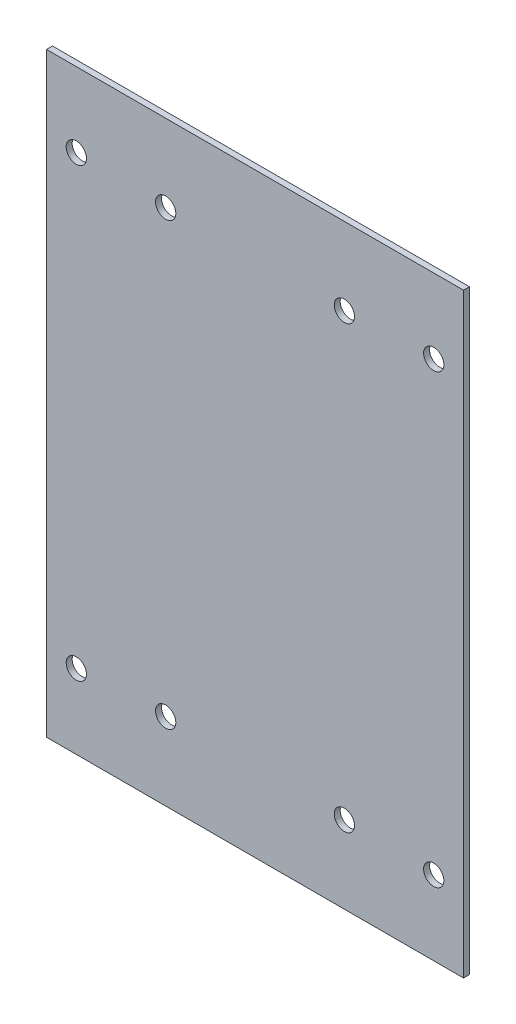
from build123d import *

# Parameters (mm, degrees)
SKETCH1_W                   = 70
SKETCH1_H                   = 100
BOSS_EXTRUDE1_DEPTH         = 1
CUT_EXTRUDE1_DEPTH          = 62.040969848
CUT_EXTRUDE1_DEPTH_BACK     = 62.040969848
SKETCH2_R                   = 1.7
LO_M3_BAT_DRIVER_DEPTH      = 62.040969848
LO_M3_BAT_DRIVER_DEPTH_BACK = 62.040969848
SKETCH3_R                   = 1.7


with BuildPart() as part:
    # Sketch1 → Boss-Extrude1 (new body)
    with BuildSketch(Plane.XY):
        Rectangle(SKETCH1_W, SKETCH1_H)
    extrude(amount=-BOSS_EXTRUDE1_DEPTH)

    # Sketch2 → Cut-Extrude1 (cut, two sides: drawn at the far end of the back side and taken through both)
    with BuildSketch(Plane.XY.offset(-CUT_EXTRUDE1_DEPTH_BACK)):
        with Locations((-30, -37.5)):
            Circle(SKETCH2_R)
        with Locations((-30, 37.5)):
            Circle(SKETCH2_R)
        with Locations((30, -37.5)):
            Circle(SKETCH2_R)
        with Locations((30, 37.5)):
            Circle(SKETCH2_R)
    extrude(amount=CUT_EXTRUDE1_DEPTH + CUT_EXTRUDE1_DEPTH_BACK, mode=Mode.SUBTRACT)

    # Sketch3 → Lo_M3_bat_driver (cut, two sides: drawn at the far end of the back side and taken through both)
    with BuildSketch(Plane.XY.offset(-LO_M3_BAT_DRIVER_DEPTH_BACK)):
        with Locations(Location((-15, -37, 0), (0, 0, 180))):
            Circle(SKETCH3_R)
        with Locations(Location((-15, 37, 0), (0, 0, 180))):
            Circle(SKETCH3_R)
        with Locations(Location((15, -37, 0), (0, 0, 180))):
            Circle(SKETCH3_R)
        with Locations(Location((15, 37, 0), (0, 0, 180))):
            Circle(SKETCH3_R)
    extrude(amount=LO_M3_BAT_DRIVER_DEPTH + LO_M3_BAT_DRIVER_DEPTH_BACK, mode=Mode.SUBTRACT)


solid = part.part
